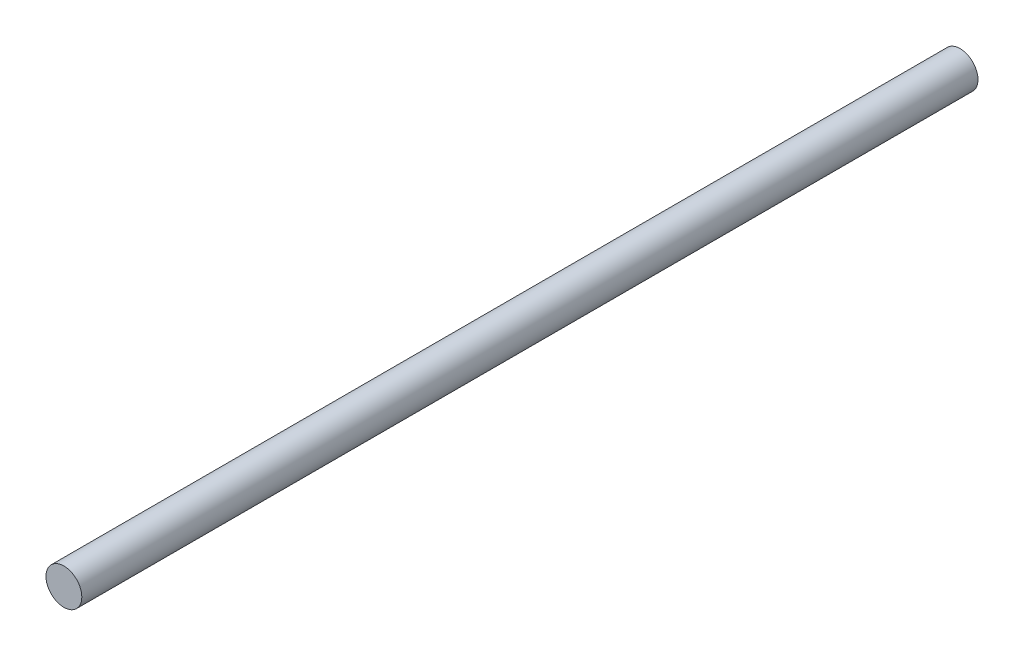
from build123d import *

# Parameters (mm, degrees)
SKETCH1_R           = 3
BOSS_EXTRUDE1_DEPTH = 150


with BuildPart() as part:
    # Sketch1 → Boss-Extrude1 (new body)
    with BuildSketch(Plane.XY):
        Circle(SKETCH1_R)
    extrude(amount=BOSS_EXTRUDE1_DEPTH)


solid = part.part
